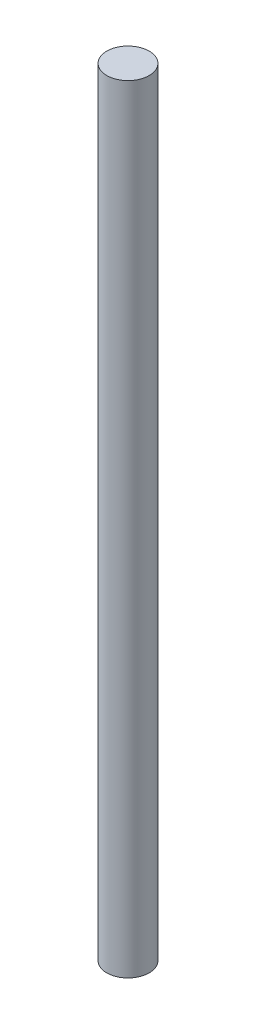
from build123d import *

# Parameters (mm, degrees)
SKETCH1_R           = 6
BOSS_EXTRUDE1_DEPTH = 220


with BuildPart() as part:
    # Sketch1 → Boss-Extrude1 (new body)
    with BuildSketch(Plane(origin=(0, 0, 0), x_dir=(1, 0, 0), z_dir=(0, 1, 0))):
        with Locations(Location((0, 0, 0), (0, 0, 270))):
            Circle(SKETCH1_R)
    extrude(amount=BOSS_EXTRUDE1_DEPTH)


solid = part.part
